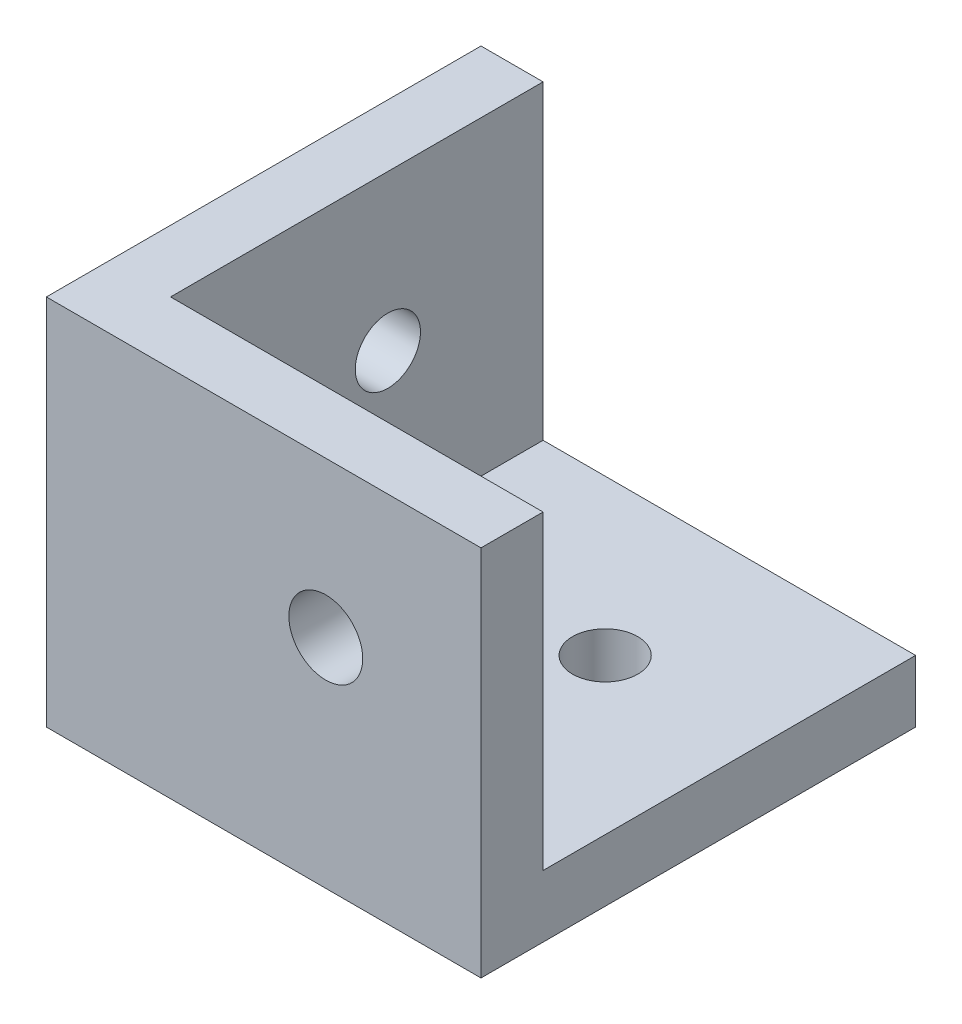
from build123d import *

# Parameters (mm, degrees)
SKETCH_1_W          = 24
SKETCH_1_H          = 24
SKETCH_1_R          = 2.1
EXTRUDE_1_DEPTH     = 4
EXTRUDE_2_DEPTH     = 24
SKETCH_2_R          = 2.379936998
CUT_EXTRUDE_1_DEPTH = 41.199502484
SKETCH_3_R          = 2.1
CUT_EXTRUDE_2_DEPTH = 41.199502484


with BuildPart() as part:
    # 草图1 → 凸台-拉伸1 (new body)
    with BuildSketch(Plane(origin=(0, 0, 0), x_dir=(1, 0, 0), z_dir=(0, 1, 0))):
        Rectangle(SKETCH_1_W, SKETCH_1_H)
        with Locations((2, 2)):
            Circle(SKETCH_1_R, mode=Mode.SUBTRACT)
    extrude(amount=EXTRUDE_1_DEPTH)

    # 草图1<3> → 凸台-拉伸2 (add)
    with BuildSketch(Plane(origin=(0, 0, 0), x_dir=(1, 0, 0), z_dir=(0, 1, 0))):
        Polygon((-12, -12), (-12, 12), (-16, 12), (-16, -16), (12, -16), (12, -12), align=None)
    extrude(amount=EXTRUDE_2_DEPTH)

    # 草图2 → 切除-拉伸1 (cut, through all)
    with BuildSketch(Plane.XY.offset(16)):
        with Locations((2, 14)):
            Circle(SKETCH_2_R)
    extrude(amount=-CUT_EXTRUDE_1_DEPTH, mode=Mode.SUBTRACT)

    # 草图3 → 切除-拉伸2 (cut, through all)
    with BuildSketch(Plane.ZY.offset(16)):
        with Locations((-2, 14)):
            Circle(SKETCH_3_R)
    extrude(amount=-CUT_EXTRUDE_2_DEPTH, mode=Mode.SUBTRACT)


solid = part.part
